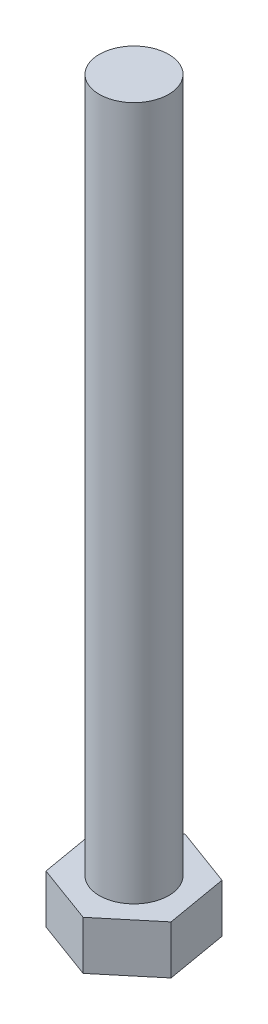
from build123d import *

# Parameters (mm, degrees)
EXTRUDE_1_DEPTH = 3.5
SKETCH_2_R      = 2.5
EXTRUDE_2_DEPTH = 50


with BuildPart() as part:
    # Эскиз1 → Вытянуть1 (new body)
    with BuildSketch(Plane(origin=(0, 0, 0), x_dir=(1, 0, 0), z_dir=(0, 1, 0))):
        Polygon((4.22329074, -1.553645816), (3.457142116, 2.88065416), (-0.766148625, 4.434299977), (-4.22329074, 1.553645816), (-3.457142116, -2.88065416), (0.766148625, -4.434299977), align=None)
    extrude(amount=EXTRUDE_1_DEPTH)

    # Эскиз2 → Вытянуть2 (add)
    with BuildSketch(Plane(origin=(0, 3.5, 0), x_dir=(1, 0, 0), z_dir=(0, 1, 0))):
        with Locations(Location((0, 0, 0), (0, 0, 270))):
            Circle(SKETCH_2_R)
    extrude(amount=EXTRUDE_2_DEPTH)


solid = part.part
